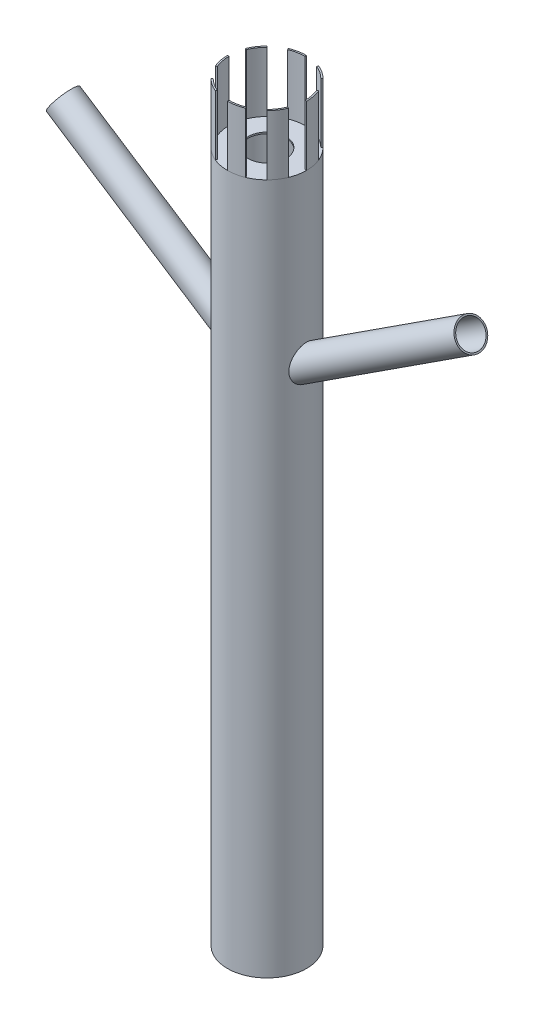
from build123d import *

# Parameters (mm, degrees)
CONNECTORPIECE_R           = 25
CONNECTORPIECE_R_2         = 22
VELCRO_CONNECTION_DEPTH    = 39.390903205
CONNECTORPIECE_6_R         = 26
CONNECTORPIECE_6_R_2       = 25
FABRIC_DEPTH               = 453.972644869
TOP_START                  = -1
SKETCH2_R                  = 25
SKETCH2_R_2                = 12.5
TOP_HOLE_DEPTH             = 1
ARM_1_EXTRUSION_REACH      = 413.497
ARM_1_EXTRUSION_END_RADIUS = 25
ARM_1_R                    = 9.751861444
ARM_1_R_2                  = 8.751861444
BOSS_EXTRUDE2_REACH        = 504.244
BOSS_EXTRUDE2_END_RADIUS   = 26
SKETCH4_R                  = 9.751861444
SKETCH4_R_2                = 8.751861444
BOSS_EXTRUDE4_DEPTH        = 39.390903205
BOSS_EXTRUDE4_2_DEPTH      = 39.390903205
BOSS_EXTRUDE4_3_DEPTH      = 39.390903205
BOSS_EXTRUDE4_4_DEPTH      = 39.390903205
BOSS_EXTRUDE4_5_DEPTH      = 39.390903205
BOSS_EXTRUDE4_6_DEPTH      = 39.390903205
BOSS_EXTRUDE4_7_DEPTH      = 39.390903205
BOSS_EXTRUDE4_8_DEPTH      = 39.390903205


with BuildPart() as part:
    # connectorpiece → velcro connection (new body)
    with BuildSketch(Plane(origin=(0, 0, 0), x_dir=(1, 0, 0), z_dir=(0, 1, 0))):
        Circle(CONNECTORPIECE_R)
        Circle(CONNECTORPIECE_R_2, mode=Mode.SUBTRACT)
    extrude(amount=VELCRO_CONNECTION_DEPTH)


with BuildPart() as body_2:
    # connectorpiece<6> → fabric (new body)
    with BuildSketch(Plane(origin=(0, 0, 0), x_dir=(1, 0, 0), z_dir=(0, 1, 0))):
        Circle(CONNECTORPIECE_6_R)
        Circle(CONNECTORPIECE_6_R_2, mode=Mode.SUBTRACT)
    extrude(amount=FABRIC_DEPTH)

    # Sketch2 → top hole (add)
    with BuildSketch(Plane(origin=(0, 453.972644869, 0), x_dir=(1, 0, 0), z_dir=(0, 1, 0)).offset(TOP_START)):
        Circle(SKETCH2_R)
        Circle(SKETCH2_R_2, mode=Mode.SUBTRACT)
    extrude(amount=TOP_HOLE_DEPTH)

    # arm 1 extrusion: up to this cylinder (the profile starts outside it)
    arm_1_extrusion_end = Plane(origin=(0, 414.77981, 0), z_dir=(0, -1, 0)) * Cylinder(ARM_1_EXTRUSION_END_RADIUS, 877.994, mode=Mode.PRIVATE)
    # arm 1 → arm 1 extrusion (add, up to the surface)
    with BuildSketch(Plane(origin=(-283.635608583, 184.195117915, 0), x_dir=(0, 0, -1), z_dir=(0.8386705679454215, -0.5446390350150312, 0)), mode=Mode.PRIVATE) as arm_1_extrusion_sk1:
        with Locations((0, 274.940723008)):
            Circle(ARM_1_R)
        with Locations((0, 274.940723008)):
            Circle(ARM_1_R_2, mode=Mode.SUBTRACT)
    arm_1_extrusion_tool1 = extrude(arm_1_extrusion_sk1.sketch, amount=ARM_1_EXTRUSION_REACH, mode=Mode.PRIVATE) - arm_1_extrusion_end
    add(arm_1_extrusion_tool1.solids().sort_by_distance((-133.892159, 414.77981, 9.476037))[0])


with BuildPart() as body_3:
    # Boss-Extrude2: up to this cylinder (the profile starts outside it)
    boss_extrude2_end = Plane(origin=(0, 414.77981, 0), z_dir=(0, -1, 0)) * Cylinder(BOSS_EXTRUDE2_END_RADIUS, 1061.488, mode=Mode.PRIVATE)
    # Sketch4 → Boss-Extrude2 (new, up to the surface)
    with BuildSketch(Plane(origin=(283.635608583, 184.195117915, 0), x_dir=(0, 0, 1), z_dir=(-0.8386705679454256, -0.5446390350150249, 0)), mode=Mode.PRIVATE) as boss_extrude2_sk1:
        with Locations((0, 274.940723008)):
            Circle(SKETCH4_R)
        with Locations((0, 274.940723008)):
            Circle(SKETCH4_R_2, mode=Mode.SUBTRACT)
    boss_extrude2_tool1 = extrude(boss_extrude2_sk1.sketch, amount=BOSS_EXTRUDE2_REACH, mode=Mode.PRIVATE) - boss_extrude2_end
    add(boss_extrude2_tool1.solids().sort_by_distance((133.892159, 414.77981, -9.476037))[0])


with BuildPart() as body_4:
    # Sketch5 → Boss-Extrude4 (new body)
    with BuildSketch(Plane(origin=(0, 453.972644869, 0), x_dir=(1, 0, 0), z_dir=(0, 1, 0))):
        with BuildLine():
            ThreePointArc((23.096988313, 9.567085809), (24.51963201, 4.87725805), (25, 0))
            Line((25, 0), (26, 0))
            ThreePointArc((26, 0), (25.50041729, 5.072348372), (24.020867845, 9.949769241))
            Line((24.020867845, 9.949769241), (23.096988313, 9.567085809))
        make_face()
    extrude(amount=BOSS_EXTRUDE4_DEPTH)


with BuildPart() as body_5:
    # Sketch5 → Boss-Extrude4 2 (new body)
    with BuildSketch(Plane(origin=(0, 453.972644869, 0), x_dir=(1, 0, 0), z_dir=(0, 1, 0))):
        with BuildLine():
            Line((24.020867845, -9.949769241), (23.096988313, -9.567085809))
            ThreePointArc((23.096988313, -9.567085809), (20.786740308, -13.889255825), (17.67766953, -17.67766953))
            Line((17.67766953, -17.67766953), (18.384776311, -18.384776311))
            ThreePointArc((18.384776311, -18.384776311), (21.61820992, -14.444826059), (24.020867845, -9.949769241))
        make_face()
    extrude(amount=BOSS_EXTRUDE4_2_DEPTH)


with BuildPart() as body_6:
    # Sketch5 → Boss-Extrude4 3 (new body)
    with BuildSketch(Plane(origin=(0, 453.972644869, 0), x_dir=(1, 0, 0), z_dir=(0, 1, 0))):
        with BuildLine():
            Line((9.949769241, -24.020867845), (9.567085809, -23.096988313))
            ThreePointArc((9.567085809, -23.096988313), (4.87725805, -24.51963201), (0, -25))
            Line((0, -25), (0, -26))
            ThreePointArc((0, -26), (5.072348372, -25.50041729), (9.949769241, -24.020867845))
        make_face()
    extrude(amount=BOSS_EXTRUDE4_3_DEPTH)


with BuildPart() as body_7:
    # Sketch5 → Boss-Extrude4 4 (new body)
    with BuildSketch(Plane(origin=(0, 453.972644869, 0), x_dir=(1, 0, 0), z_dir=(0, 1, 0))):
        with BuildLine():
            Line((-9.949769241, -24.020867845), (-9.567085809, -23.096988313))
            ThreePointArc((-9.567085809, -23.096988313), (-13.889255825, -20.786740308), (-17.67766953, -17.67766953))
            Line((-17.67766953, -17.67766953), (-18.384776311, -18.384776311))
            ThreePointArc((-18.384776311, -18.384776311), (-14.444826059, -21.61820992), (-9.949769241, -24.020867845))
        make_face()
    extrude(amount=BOSS_EXTRUDE4_4_DEPTH)


with BuildPart() as body_8:
    # Sketch5 → Boss-Extrude4 5 (new body)
    with BuildSketch(Plane(origin=(0, 453.972644869, 0), x_dir=(1, 0, 0), z_dir=(0, 1, 0))):
        with BuildLine():
            Line((-24.020867845, -9.949769241), (-23.096988313, -9.567085809))
            ThreePointArc((-23.096988313, -9.567085809), (-24.51963201, -4.87725805), (-25, 0))
            Line((-25, 0), (-26, 0))
            ThreePointArc((-26, 0), (-25.50041729, -5.072348372), (-24.020867845, -9.949769241))
        make_face()
    extrude(amount=BOSS_EXTRUDE4_5_DEPTH)


with BuildPart() as body_9:
    # Sketch5 → Boss-Extrude4 6 (new body)
    with BuildSketch(Plane(origin=(0, 453.972644869, 0), x_dir=(1, 0, 0), z_dir=(0, 1, 0))):
        with BuildLine():
            Line((-24.020867845, 9.949769241), (-23.096988313, 9.567085809))
            ThreePointArc((-23.096988313, 9.567085809), (-20.786740308, 13.889255825), (-17.67766953, 17.67766953))
            Line((-17.67766953, 17.67766953), (-18.384776311, 18.384776311))
            ThreePointArc((-18.384776311, 18.384776311), (-21.61820992, 14.444826059), (-24.020867845, 9.949769241))
        make_face()
    extrude(amount=BOSS_EXTRUDE4_6_DEPTH)


with BuildPart() as body_10:
    # Sketch5 → Boss-Extrude4 7 (new body)
    with BuildSketch(Plane(origin=(0, 453.972644869, 0), x_dir=(1, 0, 0), z_dir=(0, 1, 0))):
        with BuildLine():
            Line((-9.949769241, 24.020867845), (-9.567085809, 23.096988313))
            ThreePointArc((-9.567085809, 23.096988313), (-4.87725805, 24.51963201), (0, 25))
            Line((0, 25), (0, 26))
            ThreePointArc((0, 26), (-5.072348372, 25.50041729), (-9.949769241, 24.020867845))
        make_face()
    extrude(amount=BOSS_EXTRUDE4_7_DEPTH)


with BuildPart() as body_11:
    # Sketch5 → Boss-Extrude4 8 (new body)
    with BuildSketch(Plane(origin=(0, 453.972644869, 0), x_dir=(1, 0, 0), z_dir=(0, 1, 0))):
        with BuildLine():
            Line((9.949769241, 24.020867845), (9.567085809, 23.096988313))
            ThreePointArc((9.567085809, 23.096988313), (13.889255825, 20.786740308), (17.67766953, 17.67766953))
            Line((17.67766953, 17.67766953), (18.384776311, 18.384776311))
            ThreePointArc((18.384776311, 18.384776311), (14.444826059, 21.61820992), (9.949769241, 24.020867845))
        make_face()
    extrude(amount=BOSS_EXTRUDE4_8_DEPTH)


solid = Compound([part.part, body_2.part, body_3.part, body_4.part, body_5.part, body_6.part, body_7.part, body_8.part, body_9.part, body_10.part, body_11.part])
